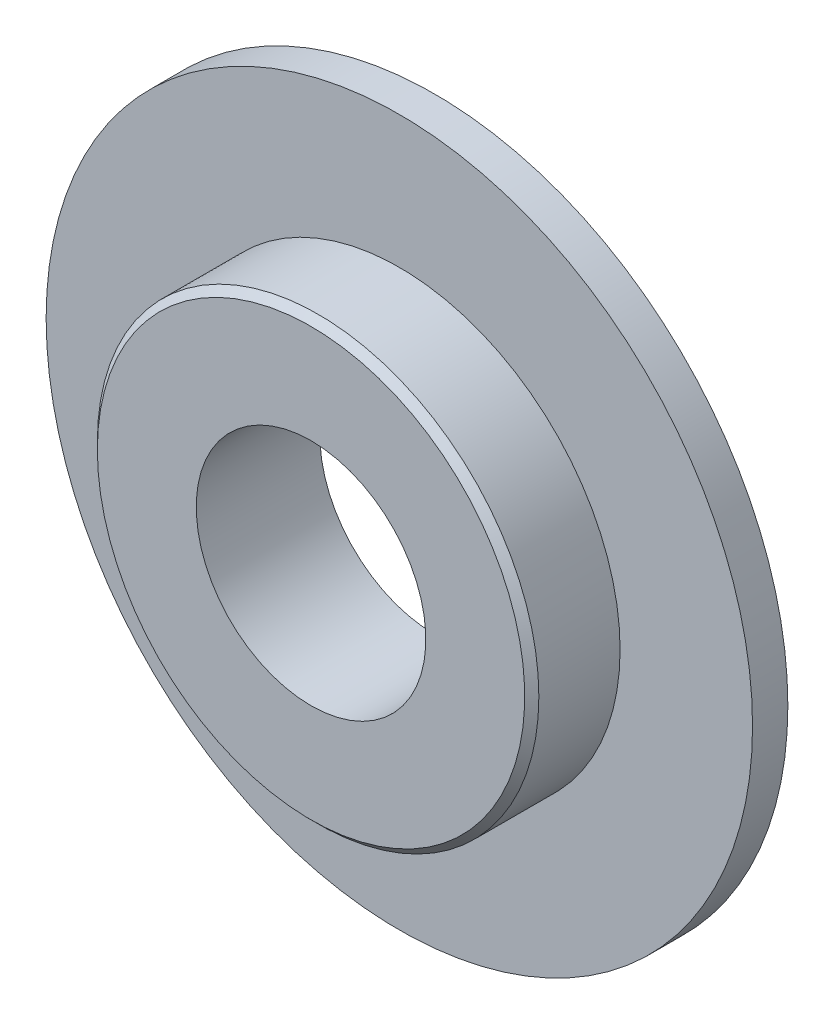
from build123d import *

# Parameters (mm, degrees)
ESQUISSE1_R             = 10
BOSS_EXTRU_1_DEPTH      = 1
ESQUISSE2_R             = 6.25
BOSS_EXTRU_2_DEPTH      = 2.5
ESQUISSE3_R             = 3.25
ENL_V_MAT_EXTRU_1_DEPTH = 15.568802284
CHANFREIN1_SIZE         = 0.2


with BuildPart() as part:
    # Esquisse1 → Boss.-Extru.1 (new body)
    with BuildSketch(Plane(origin=(38.31198223, 224.2058109, 0), x_dir=(0.9566700248572155, 0.2911742837884119, 0), z_dir=(0, 0, -1))):
        with Locations(Location((-101.934891402, 203.3355147, 0), (0, 0, 196.92827176))):
            Circle(ESQUISSE1_R)
    extrude(amount=BOSS_EXTRU_1_DEPTH)

    # Esquisse2 → Boss.-Extru.2 (add)
    with BuildSketch(Plane.XY):
        Circle(ESQUISSE2_R)
    extrude(amount=BOSS_EXTRU_2_DEPTH)

    # Esquisse3 → Enlèv. mat.-Extru.1 (cut, through all)
    with BuildSketch(Plane(origin=(0, 0, -1), x_dir=(1, 0, 0), z_dir=(0, 0, -1))):
        with Locations(Location((0, 0, 0), (0, 0, 270))):
            Circle(ESQUISSE3_R)
    extrude(amount=-ENL_V_MAT_EXTRU_1_DEPTH, mode=Mode.SUBTRACT)

    # Chanfrein1
    chanfrein1_edges = [part.edges().sort_by_distance(p)[0] for p in [
        (-6.25, 0, 2.5),
    ]]
    chamfer(chanfrein1_edges, length=CHANFREIN1_SIZE)


solid = part.part
